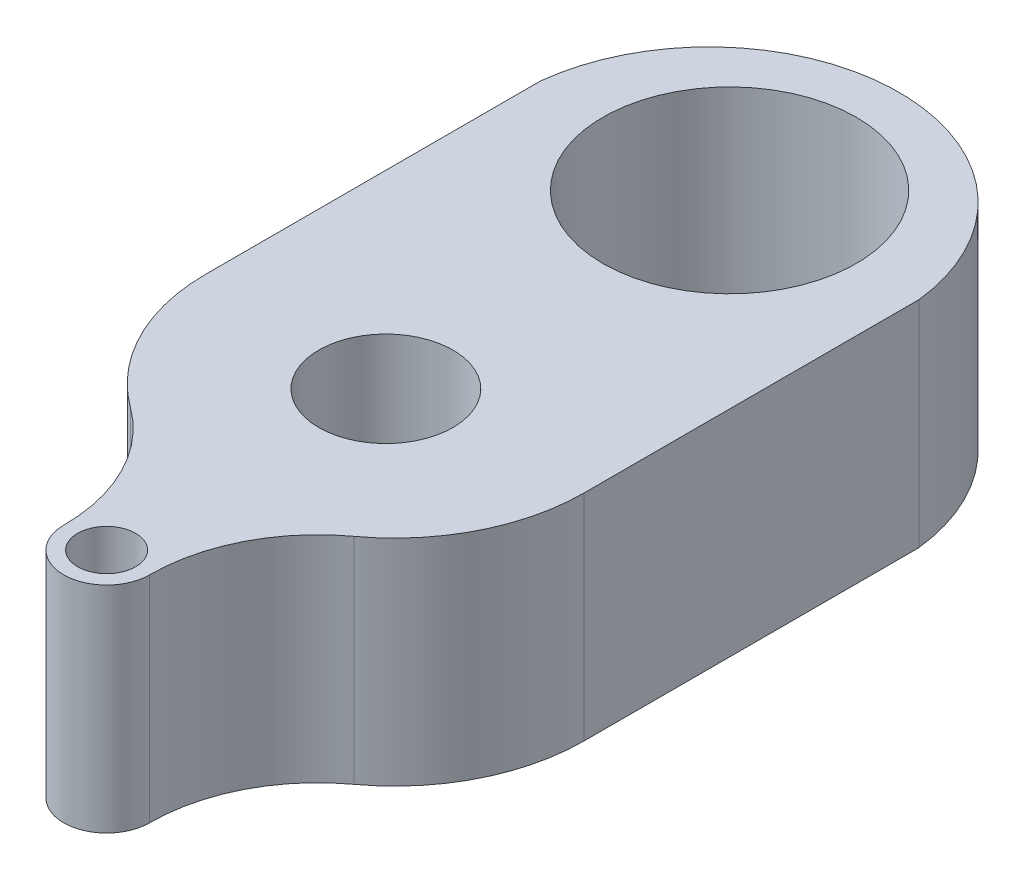
from build123d import *

# Parameters (mm, degrees)
SKETCH1_R           = 0.396875
SKETCH1_R_2         = 0.7493
SKETCH1_R_3         = 0.254
SKETCH1_R_4         = 0.17145
BOSS_EXTRUDE1_DEPTH = 1.27


with BuildPart() as part:
    # Sketch1 → Boss-Extrude1 (new body)
    # profile 1 of 2: a face of its own
    with BuildSketch(Plane(origin=(0, 0, 0), x_dir=(1, 0, 0), z_dir=(0, 1, 0))):
        with BuildLine():
            ThreePointArc((1.1191875, 3.683), (0, 4.6863), (-1.1191875, 3.683))
            Line((-1.1191875, 3.683), (-1.1191875, 1.70438291))
            ThreePointArc((-1.1191875, 1.70438291), (-0.997969385, 1.197788628), (-0.660573073, 0.800931819))
            ThreePointArc((-0.660573073, 0.800931819), (-0.361462868, 0.449108406), (-0.254, 0))
            ThreePointArc((-0.254, 0), (0, 0.254), (0.254, 0))
            ThreePointArc((0.254, 0), (0.361462868, 0.449108406), (0.660573073, 0.800931819))
            ThreePointArc((0.660573073, 0.800931819), (0.997969385, 1.197788628), (1.1191875, 1.70438291))
            Line((1.1191875, 1.70438291), (1.1191875, 3.683))
        make_face()
        with Locations(Location((0, 1.651, 0), (0, 0, 270))):
            Circle(SKETCH1_R, mode=Mode.SUBTRACT)
        with Locations(Location((0, 3.683, 0), (0, 0, 270))):
            Circle(SKETCH1_R_2, mode=Mode.SUBTRACT)
    # profile 2 of 2: a face of its own
    with BuildSketch(Plane(origin=(0, 0, 0), x_dir=(1, 0, 0), z_dir=(0, 1, 0))):
        Circle(SKETCH1_R_3)
        with Locations(Location((0, 0, 0), (0, 0, 270))):
            Circle(SKETCH1_R_4, mode=Mode.SUBTRACT)
    extrude(amount=BOSS_EXTRUDE1_DEPTH)


solid = part.part
